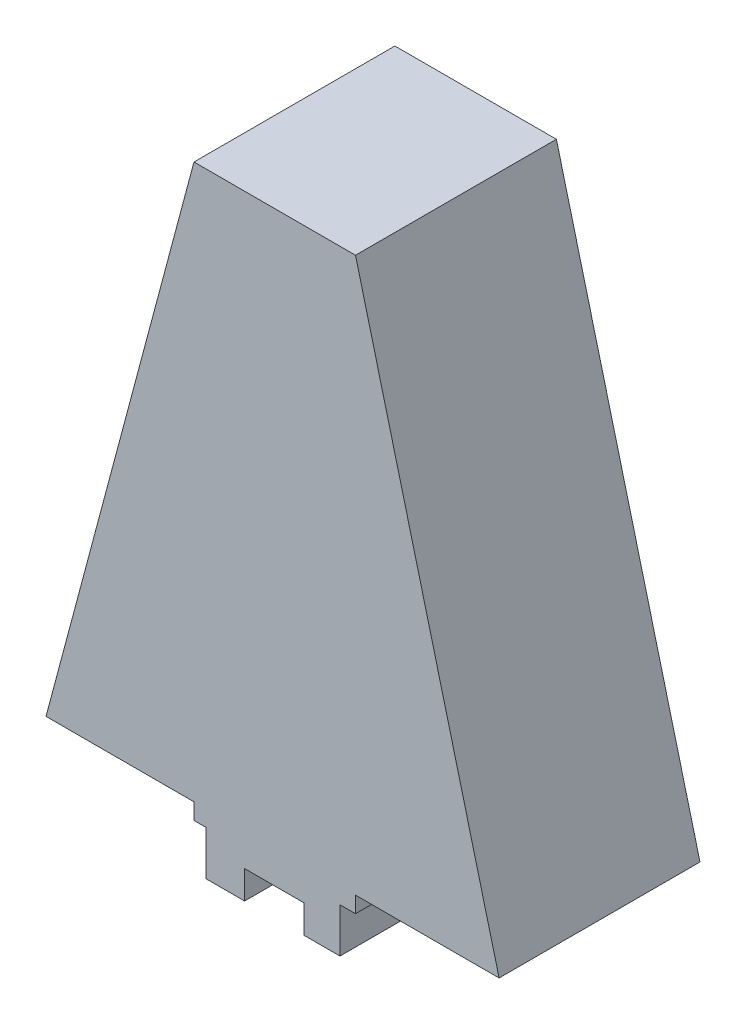
from build123d import *

# Parameters (mm, degrees)
BOSS_EXTRUDE1_DEPTH = 0.025


with BuildPart() as part:
    # Sketch2 → Boss-Extrude1 (new body)
    with BuildSketch(Plane.XY):
        Polygon((0.008165184, -0.070964452), (0.010099043, -0.070964452), (0.010099043, -0.068959778), (0.027969052, -0.068959778), (0.010099043, 0), (-0.01, 0), (-0.028413629, -0.068959778), (-0.01, -0.068959778), (-0.01, -0.070964452), (-0.0085, -0.070964452), (-0.0085, -0.072999999), (-0.0085, -0.076499999), (-0.0037, -0.076499999), (-0.0037, -0.072999999), (0.0037, -0.072999999), (0.0037, -0.076499999), (0.008165184, -0.076499999), (0.008165184, -0.072999999), align=None)
    extrude(amount=BOSS_EXTRUDE1_DEPTH)


solid = part.part
